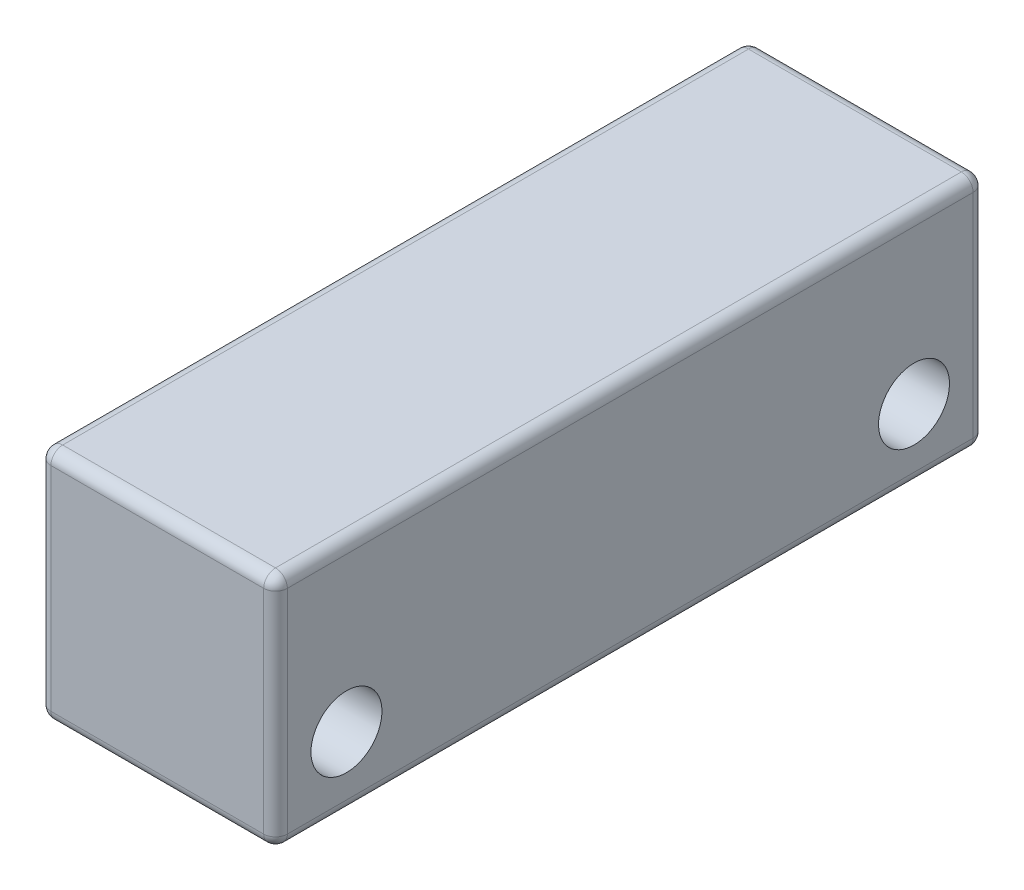
from build123d import *

# Parameters (mm, degrees)
ESQUISSE1_W             = 10
ESQUISSE1_H             = 10
BOSS_EXTRU_1_DEPTH      = 30
ESQUISSE2_R             = 1.5
ENL_V_MAT_EXTRU_1_DEPTH = 30
CONG_1_R                = 0.5
ESQUISSE3_R             = 1.5
ENL_V_MAT_EXTRU_2_DEPTH = 10


with BuildPart() as part:
    # Esquisse1 → Boss.-Extru.1 (new body)
    with BuildSketch(Plane.XY):
        Rectangle(ESQUISSE1_W, ESQUISSE1_H)
    extrude(amount=BOSS_EXTRU_1_DEPTH)

    # Esquisse2 → Enlèv. mat.-Extru.1 (cut)
    with BuildSketch(Plane(origin=(5, 0, 0), x_dir=(0, 0, -1), z_dir=(1, 0, 0))):
        with Locations(Location((-3, -2, 0), (0, 0, 90))):
            Circle(ESQUISSE2_R)
    extrude(amount=-ENL_V_MAT_EXTRU_1_DEPTH, mode=Mode.SUBTRACT)

    # Congé1
    cong_1_edges = [part.edges().sort_by_distance(p)[0] for p in [
        (-5, 0, 30),
        (0, -5, 30),
        (5, 0, 30),
        (0, -5, 0),
        (-5, 0, 0),
        (0, 5, 0),
        (5, 0, 0),
        (5, -5, 15),
        (-5, -5, 15),
        (-5, 5, 15),
        (5, 5, 15),
        (0, 5, 30),
    ]]
    fillet(cong_1_edges, radius=CONG_1_R)

    # Esquisse3 → Enlèv. mat.-Extru.2 (cut)
    with BuildSketch(Plane.ZY.offset(5)):
        with Locations((27, -2)):
            Circle(ESQUISSE3_R)
    extrude(amount=-ENL_V_MAT_EXTRU_2_DEPTH, mode=Mode.SUBTRACT)


solid = part.part
